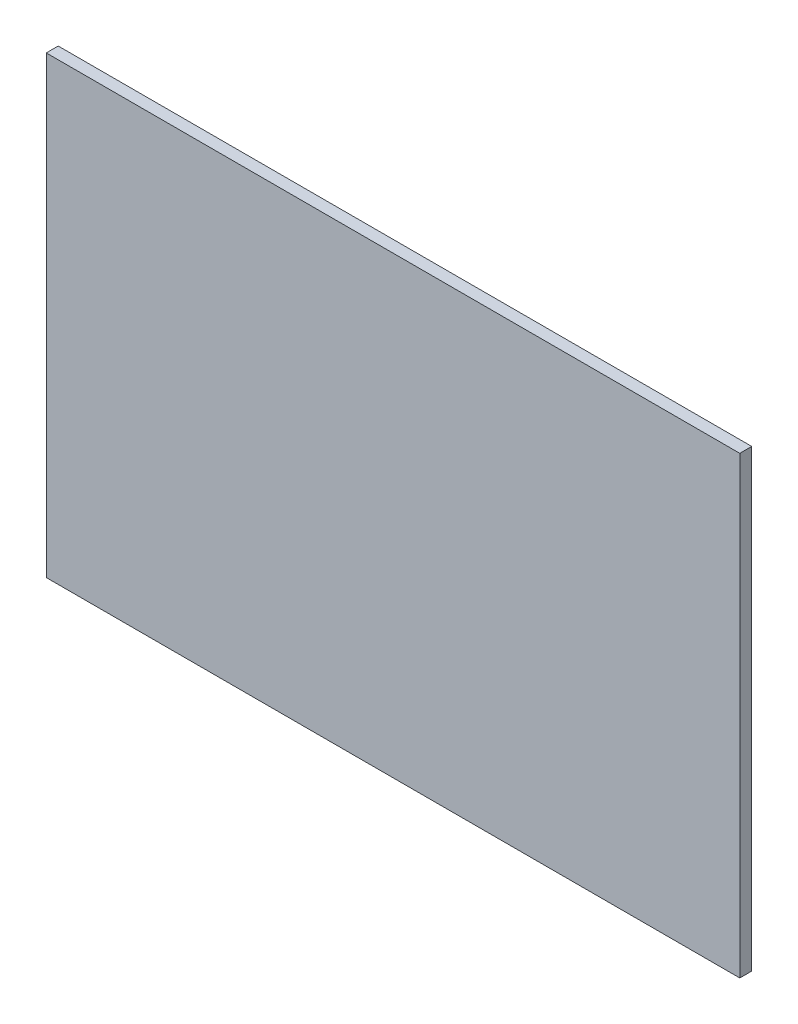
from build123d import *

# Parameters (mm, degrees)
SKETCH_1_W      = 290
SKETCH_1_H      = 190
EXTRUDE_1_DEPTH = 5


with BuildPart() as part:
    # Эскиз1 → Бобышка-Вытянуть1 (new body)
    with BuildSketch(Plane.XY):
        Rectangle(SKETCH_1_W, SKETCH_1_H)
    extrude(amount=EXTRUDE_1_DEPTH)


solid = part.part
